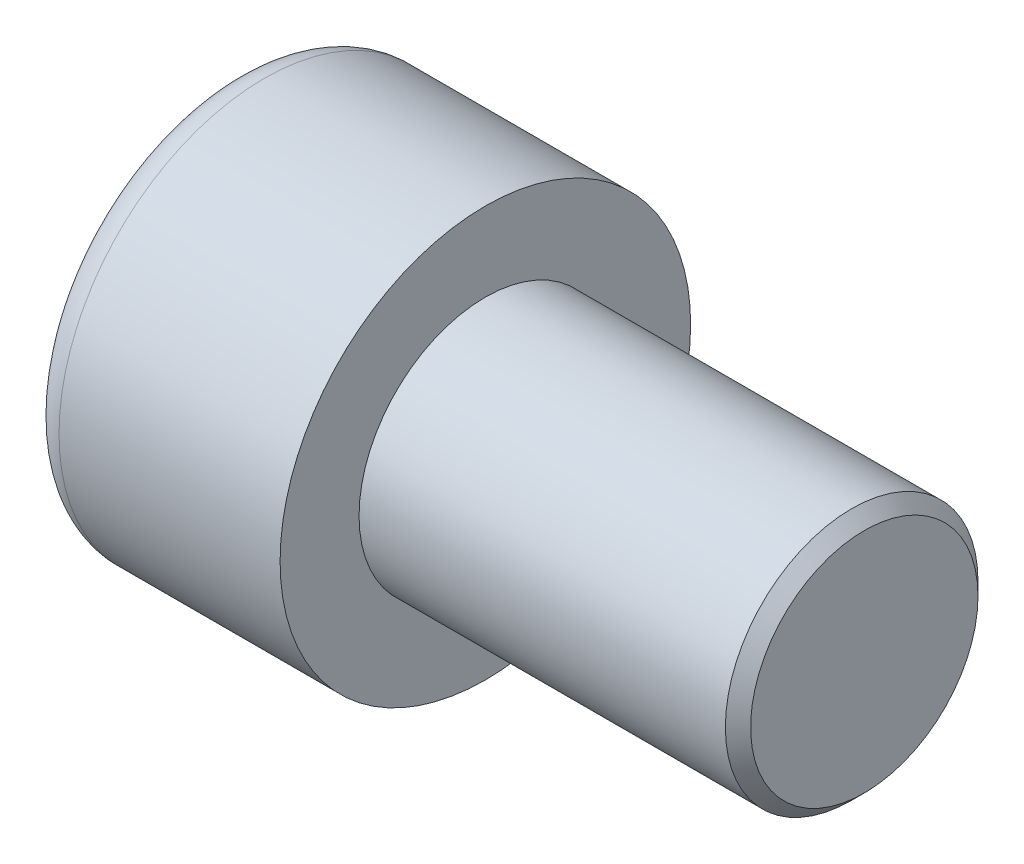
from build123d import *

# Parameters (mm, degrees)
SKETCH1_R           = 6.5
BASEHEAD_DEPTH      = 8
SKETCH2_R           = 4
BASEBODY_DEPTH      = 12
HEXAGONSOCKET_DEPTH = 4
TOPFILLET_R         = 1
CHAMFER1_SIZE       = 0.4


with BuildPart() as part:
    # Sketch1 → BaseHead (new body)
    with BuildSketch(Plane(origin=(0, 0, 0), x_dir=(0, 0, -1), z_dir=(1, 0, 0))):
        Circle(SKETCH1_R)
    extrude(amount=BASEHEAD_DEPTH)

    # Sketch2 → BaseBody (add)
    with BuildSketch(Plane(origin=(8, 0, 0), x_dir=(0, 0, -1), z_dir=(1, 0, 0))):
        Circle(SKETCH2_R)
    extrude(amount=BASEBODY_DEPTH)

    # Sketch3 → HexagonSocket (cut)
    with BuildSketch(Plane(origin=(0, 0, 0), x_dir=(0, 0, -1), z_dir=(1, 0, 0))):
        Polygon((3.464101615, 0), (1.732050808, 3), (-1.732050808, 3), (-3.464101615, 0), (-1.732050808, -3), (1.732050808, -3), align=None)
    extrude(amount=HEXAGONSOCKET_DEPTH, mode=Mode.SUBTRACT)

    # Sketch4 → Cut-Revolve1 (revolve, cut)
    with BuildSketch(Plane(origin=(-4.19613823, 0.75, 0), x_dir=(-1, 0, 0), z_dir=(0, 0, 1)), mode=Mode.PRIVATE) as cut_revolve1_sk:
        Polygon((-8.19613823, 3.75), (-9.928189037, 0.75), (-8.19613823, 0.75), align=None)
    revolve(cut_revolve1_sk.sketch.rotate(Axis((0.838992387, 0, 0), (-1, 0, 0)), 90), axis=Axis((0.838992387, 0, 0), (-1, 0, 0)), mode=Mode.SUBTRACT)

    # TopFillet
    topfillet_edges = [part.edges().sort_by_distance(p)[0] for p in [
        (0, 0, 6.5),
    ]]
    fillet(topfillet_edges, radius=TOPFILLET_R)

    # Chamfer1
    chamfer1_edges = [part.edges().sort_by_distance(p)[0] for p in [
        (20, 0, 4),
    ]]
    chamfer(chamfer1_edges, length=CHAMFER1_SIZE)


solid = part.part
